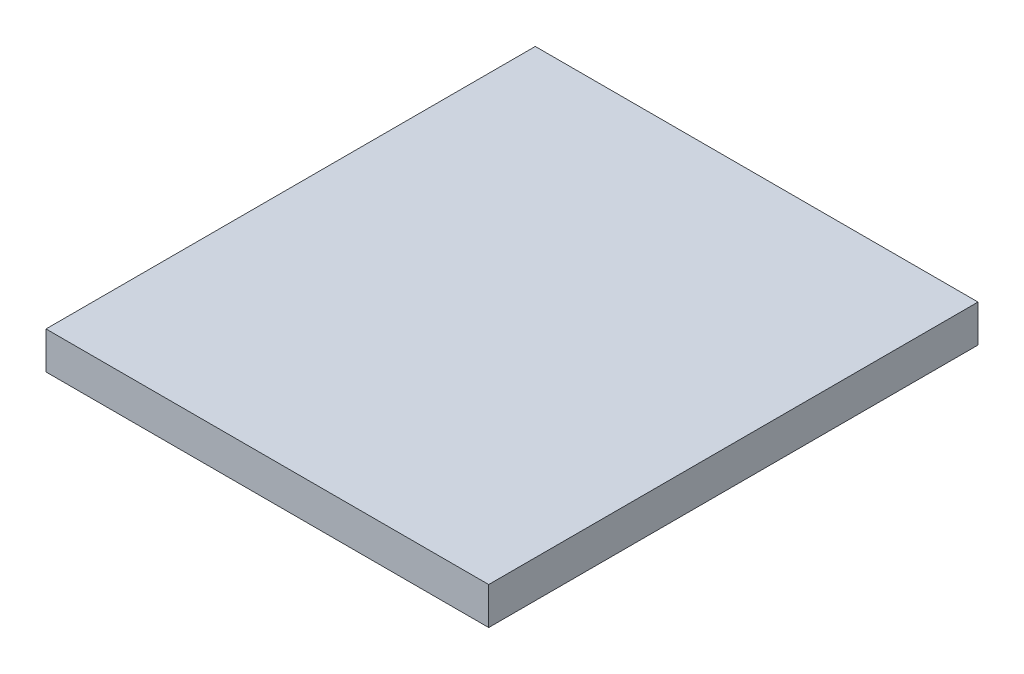
from build123d import *

# Parameters (mm, degrees)
SKETCH_1_W      = 19
SKETCH_1_H      = 21
EXTRUDE_1_DEPTH = 1.6


with BuildPart() as part:
    # 草图1 → 凸台-拉伸1 (new body)
    with BuildSketch(Plane(origin=(0, 0, 0), x_dir=(1, 0, 0), z_dir=(0, 1, 0))):
        with Locations((-9.5, 10.5)):
            Rectangle(SKETCH_1_W, SKETCH_1_H)
    extrude(amount=EXTRUDE_1_DEPTH)


solid = part.part
